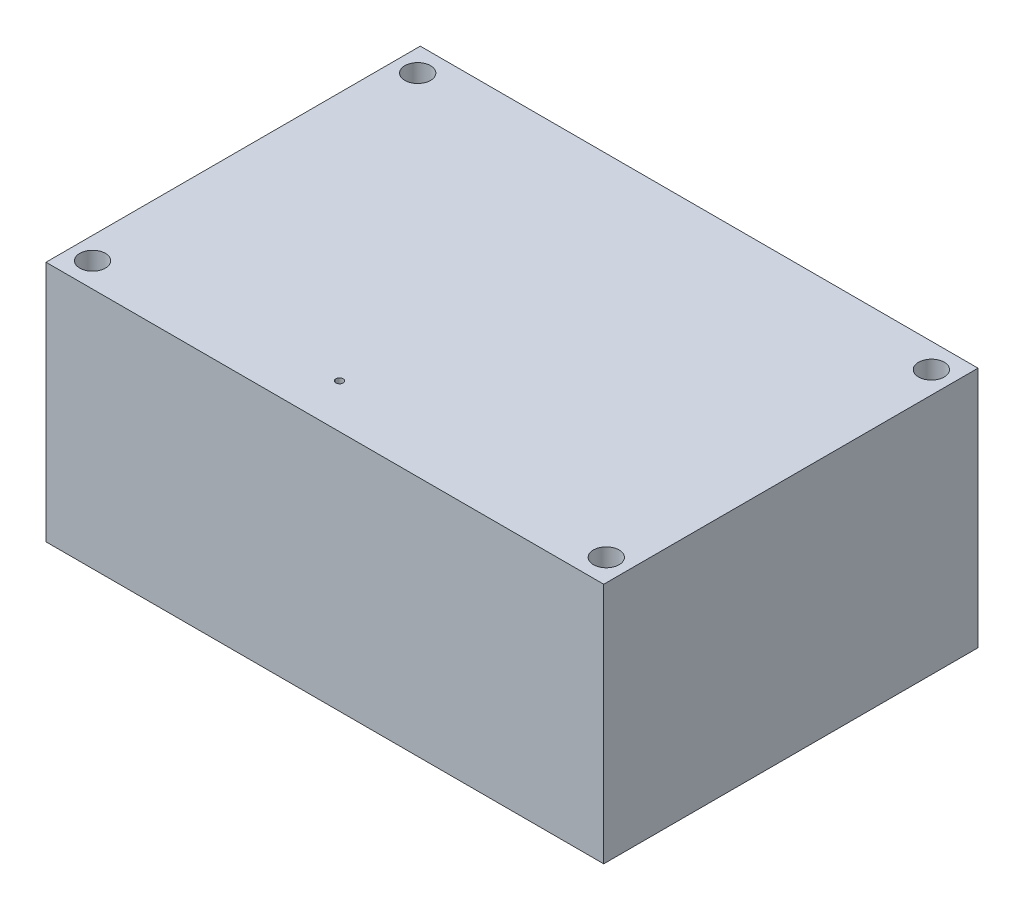
from build123d import *

# Parameters (mm, degrees)
SKETCH1_W                 = 76
SKETCH1_H                 = 51
BOSS_EXTRUDE1_DEPTH       = 33
SKETCH2_R                 = 1.75
CUT_EXTRUDE1_DEPTH        = 57.420297766
SKETCH3_R                 = 0.5
IMU_CENTER_LOCATION_DEPTH = 5


with BuildPart() as part:
    # Sketch1 → Boss-Extrude1 (new body)
    with BuildSketch(Plane(origin=(0, 0, 0), x_dir=(1, 0, 0), z_dir=(0, 1, 0))):
        Rectangle(SKETCH1_W, SKETCH1_H)
    extrude(amount=BOSS_EXTRUDE1_DEPTH)

    # Sketch2 → Cut-Extrude1 (cut, through all)
    with BuildSketch(Plane(origin=(0, 0, 0), x_dir=(1, 0, 0), z_dir=(0, 1, 0))):
        with Locations(Location((-35, 22.15, 0), (0, 0, 270))):
            Circle(SKETCH2_R)
        with Locations(Location((35, 22.15, 0), (0, 0, 270))):
            Circle(SKETCH2_R)
        with Locations(Location((35, -22.15, 0), (0, 0, 270))):
            Circle(SKETCH2_R)
        with Locations(Location((-35, -22.15, 0), (0, 0, 270))):
            Circle(SKETCH2_R)
    extrude(amount=CUT_EXTRUDE1_DEPTH, mode=Mode.SUBTRACT)

    # Sketch3 → IMU_center_location (cut)
    with BuildSketch(Plane(origin=(0, 33, 0), x_dir=(1, 0, 0), z_dir=(0, 1, 0))):
        with Locations(Location((-4, -19.5, 0), (0, 0, 270))):
            Circle(SKETCH3_R)
    extrude(amount=-IMU_CENTER_LOCATION_DEPTH, mode=Mode.SUBTRACT)


solid = part.part
